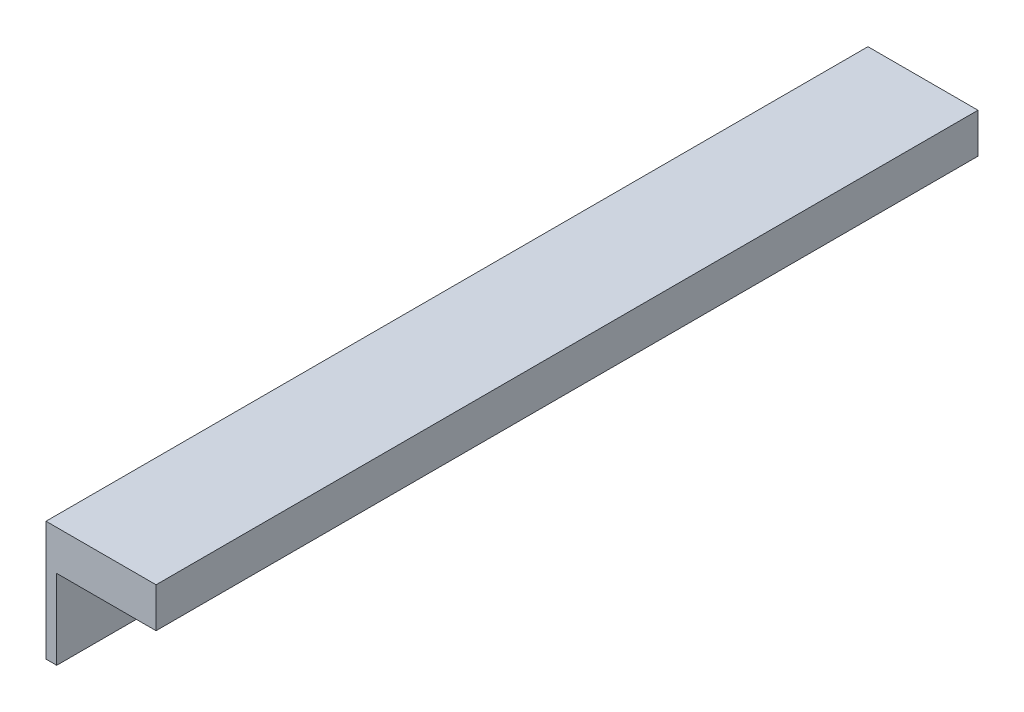
from build123d import *

# Parameters (mm, degrees)
SKETCH1_W               = 108.761980125
SKETCH1_H               = 61.936744186
BOSS_EXTRUDE1_DEPTH     = 2
SKETCH2_R               = 2.4
CUT_EXTRUDE1_DEPTH      = 63.943741049
MIRROR2_COPY_1_SKETCH_R = 2.4
MIRROR2_COPY_1_DEPTH    = 63.943741049
SKETCH3_W               = 94.024869854
SKETCH3_H               = 56.555498618
CUT_EXTRUDE2_DEPTH      = 63.943741049
SKETCH6_W               = 101.2762547
SKETCH6_H               = 61.936744186
CUT_EXTRUDE5_DEPTH      = 10
SKETCH8_W               = 0.808555921
SKETCH8_H               = 61.936744186
BOSS_EXTRUDE2_DEPTH     = 8
SKETCH10_W              = 8.294281346
SKETCH10_H              = 61.936744186
BOSS_EXTRUDE4_DEPTH     = 1
CUT_EXTRUDE6_START      = -0.5
SKETCH11_R              = 2.4
CUT_EXTRUDE6_DEPTH      = 0.5


with BuildPart() as part:
    # Sketch1 → Boss-Extrude1 (new body)
    with BuildSketch(Plane(origin=(0, 0, 0), x_dir=(1, 0, 0), z_dir=(0, 1, 0))):
        with Locations((-0.380990063, 0)):
            Rectangle(SKETCH1_W, SKETCH1_H)
    extrude(amount=BOSS_EXTRUDE1_DEPTH)

    # Sketch2 → Cut-Extrude1 (cut, symmetric)
    with BuildSketch(Plane(origin=(0, 2, 0), x_dir=(1, 0, 0), z_dir=(0, 1, 0))):
        with Locations(Location((-50.814865351, 26.477784527, 0), (0, 0, 270))):
            Circle(SKETCH2_R)
    cut_extrude1 = extrude(amount=CUT_EXTRUDE1_DEPTH, both=True, mode=Mode.SUBTRACT)

    # Mirror1: Cut-Extrude1 across plane
    add(cut_extrude1.mirror(Plane.XY), mode=Mode.SUBTRACT)

    # Mirror2: Cut-Extrude1 across plane
    add(cut_extrude1.mirror(Plane.ZY.offset(0.380990062)), mode=Mode.SUBTRACT)

    # Mirror2 copy 1 sketch → Mirror2 copy 1 (cut, symmetric)
    with BuildSketch(Plane(origin=(-0.761980125, 2, 0), x_dir=(-1, 0, 0), z_dir=(0, 1, 0))):
        with Locations(Location((-50.814865351, 26.477784527, 0), (0, 0, 270))):
            Circle(MIRROR2_COPY_1_SKETCH_R)
    extrude(amount=MIRROR2_COPY_1_DEPTH, both=True, mode=Mode.SUBTRACT)

    # Sketch3 → Cut-Extrude2 (cut, through all)
    with BuildSketch(Plane(origin=(0, 2, 0), x_dir=(1, 0, 0), z_dir=(0, 1, 0))):
        Rectangle(SKETCH3_W, SKETCH3_H)
    extrude(amount=-CUT_EXTRUDE2_DEPTH, mode=Mode.SUBTRACT)

    # Sketch6 → Cut-Extrude5 (cut)
    with BuildSketch(Plane(origin=(0, 2, 0), x_dir=(1, 0, 0), z_dir=(0, 1, 0))):
        with Locations((3.36187265, 0)):
            Rectangle(SKETCH6_W, SKETCH6_H)
    extrude(amount=-CUT_EXTRUDE5_DEPTH, mode=Mode.SUBTRACT)

    # Sketch8 → Boss-Extrude2 (add)
    with BuildSketch(Plane(origin=(0, 2, 0), x_dir=(1, 0, 0), z_dir=(0, 1, 0))):
        with Locations((-55.166258086, 0)):
            Rectangle(SKETCH8_W, SKETCH8_H)
    extrude(amount=-BOSS_EXTRUDE2_DEPTH)

    # Sketch10 → Boss-Extrude4 (add)
    with BuildSketch(Plane(origin=(0, 2, 0), x_dir=(1, 0, 0), z_dir=(0, 1, 0))):
        with Locations((-51.423395373, 0)):
            Rectangle(SKETCH10_W, SKETCH10_H)
    extrude(amount=BOSS_EXTRUDE4_DEPTH)

    # Sketch11 → Cut-Extrude6 (cut)
    with BuildSketch(Plane.XZ.offset(-2).offset(CUT_EXTRUDE6_START)):
        with Locations(Location((-50.814865351, -26.477784527, 0), (0, 0, 90))):
            Circle(SKETCH11_R)
        with Locations(Location((-50.814865351, 26.477784527, 0), (0, 0, 270))):
            Circle(SKETCH11_R)
    extrude(amount=CUT_EXTRUDE6_DEPTH, mode=Mode.SUBTRACT)


solid = part.part
